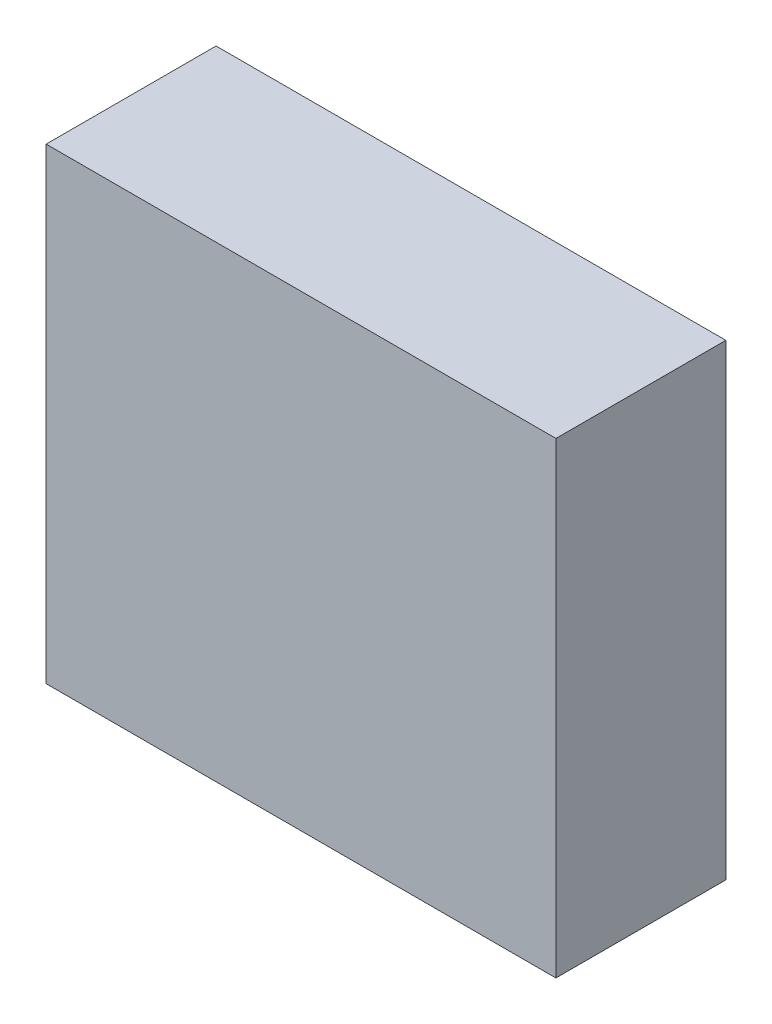
from build123d import *

# Parameters (mm, degrees)
SKETCH1_W           = 152.4
SKETCH1_H           = 139.7
BOSS_EXTRUDE1_DEPTH = 50.8


with BuildPart() as part:
    # Sketch1 → Boss-Extrude1 (new body)
    with BuildSketch(Plane.XY):
        Rectangle(SKETCH1_W, SKETCH1_H)
    extrude(amount=BOSS_EXTRUDE1_DEPTH)


solid = part.part
